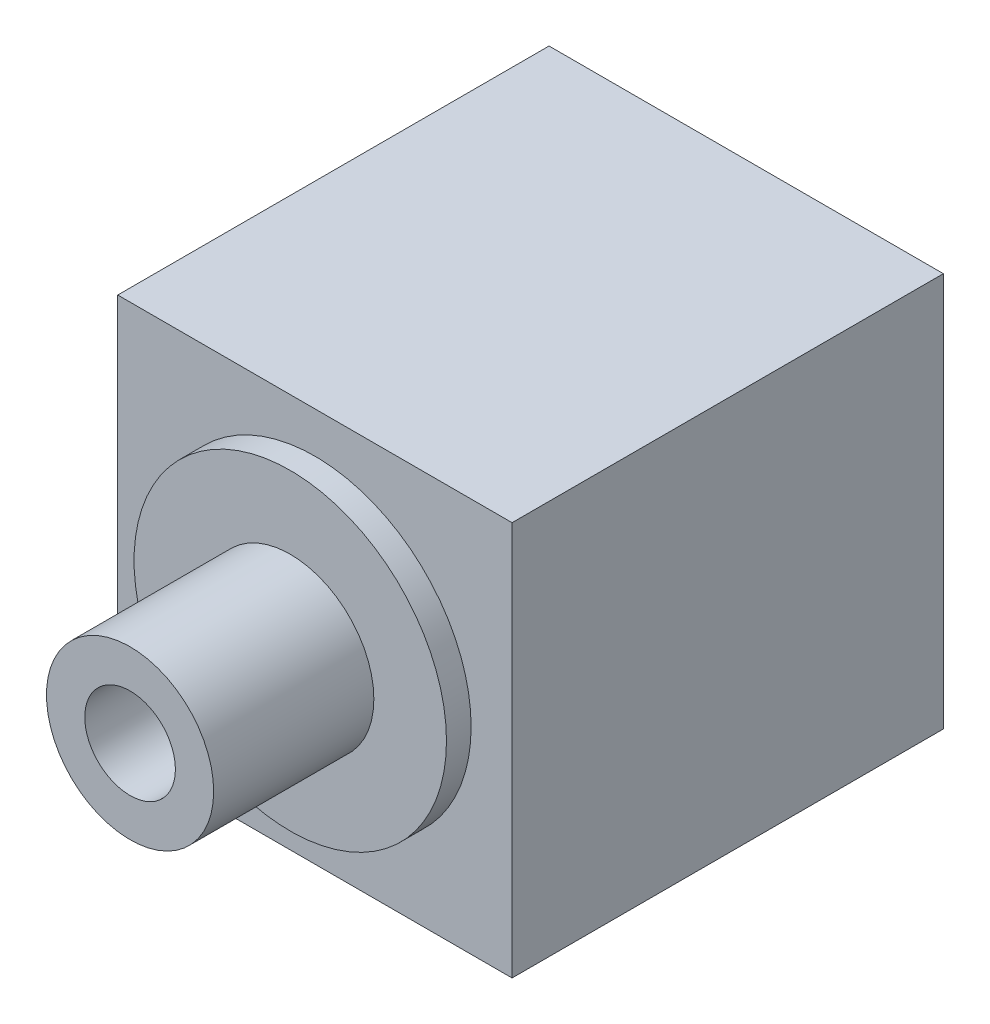
from build123d import *

# Parameters (mm, degrees)
ESQUISSE1_W        = 32
ESQUISSE1_H        = 32
BOSS_EXTRU_1_DEPTH = 35
ESQUISSE2_R        = 6.784029575
ESQUISSE2_R_2      = 3.677937746
BOSS_EXTRU_2_DEPTH = 15
ESQUISSE3_R        = 12.676726104
BOSS_EXTRU_3_DEPTH = 2


with BuildPart() as part:
    # Esquisse1 → Boss.-Extru.1 (new body)
    with BuildSketch(Plane.XY):
        Rectangle(ESQUISSE1_W, ESQUISSE1_H)
    extrude(amount=BOSS_EXTRU_1_DEPTH)

    # Esquisse2 → Boss.-Extru.2 (add)
    with BuildSketch(Plane.XY.offset(35)):
        Circle(ESQUISSE2_R)
        Circle(ESQUISSE2_R_2, mode=Mode.SUBTRACT)
    extrude(amount=BOSS_EXTRU_2_DEPTH)

    # Esquisse3 → Boss.-Extru.3 (add)
    with BuildSketch(Plane.XY.offset(35)):
        Circle(ESQUISSE3_R)
    extrude(amount=BOSS_EXTRU_3_DEPTH)


solid = part.part
